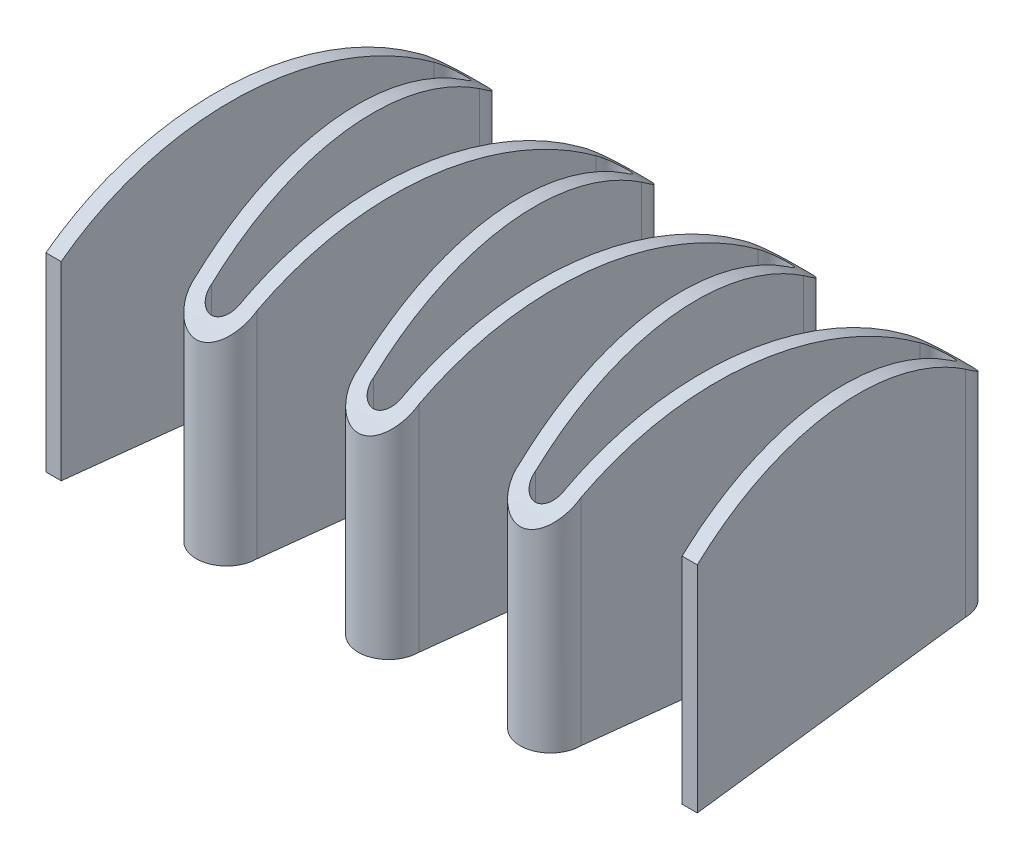
from build123d import *

# Parameters (mm, degrees)
EXTRUDE_2_DEPTH          = 13
CUT_EXTRUDE_1_DEPTH      = 35.406576406
CUT_EXTRUDE_1_DEPTH_BACK = 35.406576406


with BuildPart() as part:
    # 草图1 → 凸台-拉伸2 (new body)
    with BuildSketch(Plane(origin=(0, 0, 0), x_dir=(1, 0, 0), z_dir=(0, 1, 0))):
        with BuildLine():
            Line((0.75, 15), (2.5, 0))
            ThreePointArc((2.5, 0), (4, -1.5), (5.5, 0))
            Line((5.5, 0), (7.25, 15))
            ThreePointArc((7.25, 15), (8, 15.75), (8.75, 15))
            Line((8.75, 15), (10.5, 0))
            ThreePointArc((10.5, 0), (12, -1.5), (13.5, 0))
            Line((13.5, 0), (15.25, 15))
            ThreePointArc((15.25, 15), (16, 15.75), (16.75, 15))
            Line((16.75, 15), (18.5, 0))
            ThreePointArc((18.5, 0), (20, -1.5), (21.5, 0))
            Line((21.5, 0), (23.25, 15))
            ThreePointArc((23.25, 15), (24, 15.75), (24.75, 15))
            Line((24.75, 15), (26.5, 0))
            Line((26.5, 0), (27.25, 0))
            Line((27.25, 0), (25.5, 15))
            ThreePointArc((25.5, 15), (24, 16.5), (22.5, 15))
            Line((22.5, 15), (20.75, 0))
            ThreePointArc((20.75, 0), (20, -0.75), (19.25, 0))
            Line((19.25, 0), (17.5, 15))
            ThreePointArc((17.5, 15), (16, 16.5), (14.5, 15))
            Line((14.5, 15), (12.75, 0))
            ThreePointArc((12.75, 0), (12, -0.75), (11.25, 0))
            Line((11.25, 0), (9.5, 15))
            ThreePointArc((9.5, 15), (8, 16.5), (6.5, 15))
            Line((6.5, 15), (4.75, 0))
            ThreePointArc((4.75, 0), (4, -0.75), (3.25, 0))
            Line((3.25, 0), (1.5, 15))
            ThreePointArc((1.5, 15), (0, 16.5), (-1.5, 15))
            Line((-1.5, 15), (-3.425, -1.5))
            Line((-3.425, -1.5), (-2.675, -1.5))
            Line((-2.675, -1.5), (-0.75, 15))
            ThreePointArc((-0.75, 15), (0, 15.75), (0.75, 15))
        make_face()
    extrude(amount=EXTRUDE_2_DEPTH)

    # 草图2 → 切除-拉伸1 (cut, two sides: drawn at the far end of the back side and taken through both)
    with BuildSketch(Plane(origin=(0, 0, 0), x_dir=(0, 0, -1), z_dir=(1, 0, 0)).offset(-CUT_EXTRUDE_1_DEPTH_BACK)):
        with BuildLine():
            Line((7.5, 13), (-1.5, 13))
            Line((-1.5, 13), (-1.5, 9.38083152))
            ThreePointArc((-1.5, 9.38083152), (2.649784013, 12.061318538), (7.5, 13))
        make_face()
        with BuildLine():
            Line((16.5, 13), (7.5, 13))
            ThreePointArc((7.5, 13), (12.350215987, 12.061318538), (16.5, 9.38083152))
            Line((16.5, 9.38083152), (16.5, 13))
        make_face()
    extrude(amount=CUT_EXTRUDE_1_DEPTH + CUT_EXTRUDE_1_DEPTH_BACK, mode=Mode.SUBTRACT)


solid = part.part
